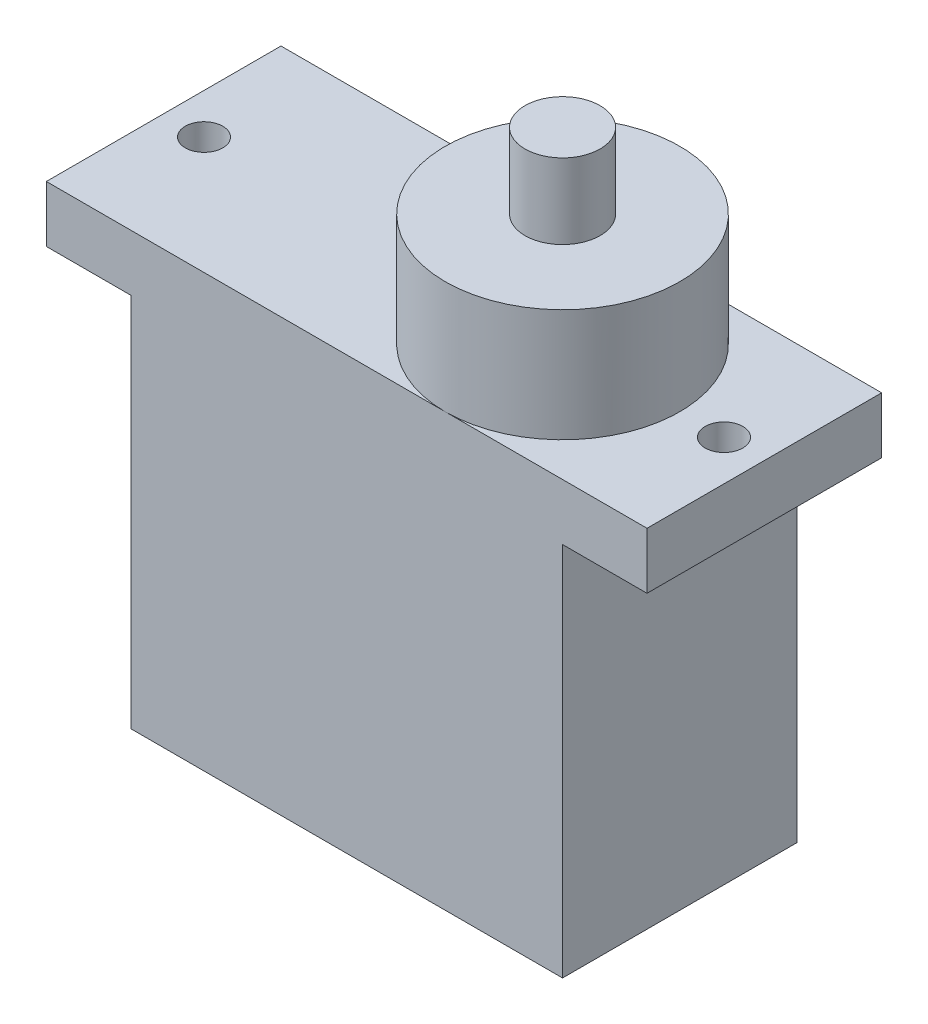
from build123d import *

# Parameters (mm, degrees)
SKETCH_1_W      = 23
SKETCH_1_H      = 12.5
EXTRUDE_1_DEPTH = 20
SKETCH_2_W      = 32
SKETCH_2_H      = 12.5
SKETCH_2_R      = 1
EXTRUDE_2_DEPTH = 3
SKETCH_4_R      = 6.25
EXTRUDE_3_DEPTH = 6
SKETCH_5_R      = 2
EXTRUDE_4_DEPTH = 4


with BuildPart() as part:
    # 草图1 → 凸台-拉伸1 (new body)
    with BuildSketch(Plane(origin=(0, 0, 0), x_dir=(1, 0, 0), z_dir=(0, 1, 0))):
        Rectangle(SKETCH_1_W, SKETCH_1_H)
    extrude(amount=EXTRUDE_1_DEPTH)

    # 草图2 → 凸台-拉伸2 (add)
    with BuildSketch(Plane(origin=(0, 20, 0), x_dir=(1, 0, 0), z_dir=(0, 1, 0))):
        Rectangle(SKETCH_2_W, SKETCH_2_H)
        with Locations(Location((13.85, 0, 0), (0, 0, 270))):
            Circle(SKETCH_2_R, mode=Mode.SUBTRACT)
        with Locations(Location((-13.85, 0, 0), (0, 0, 90))):
            Circle(SKETCH_2_R, mode=Mode.SUBTRACT)
    extrude(amount=EXTRUDE_2_DEPTH)

    # 草图4 → 凸台-拉伸3 (add)
    with BuildSketch(Plane(origin=(0, 23, 0), x_dir=(1, 0, 0), z_dir=(0, 1, 0))):
        with Locations(Location((5.25, 0, 0), (0, 0, 270))):
            Circle(SKETCH_4_R)
    extrude(amount=EXTRUDE_3_DEPTH)

    # 草图5 → 凸台-拉伸4 (add)
    with BuildSketch(Plane(origin=(0, 29, 0), x_dir=(1, 0, 0), z_dir=(0, 1, 0))):
        with Locations(Location((5.25, 0, 0), (0, 0, 270))):
            Circle(SKETCH_5_R)
    extrude(amount=EXTRUDE_4_DEPTH)


solid = part.part
